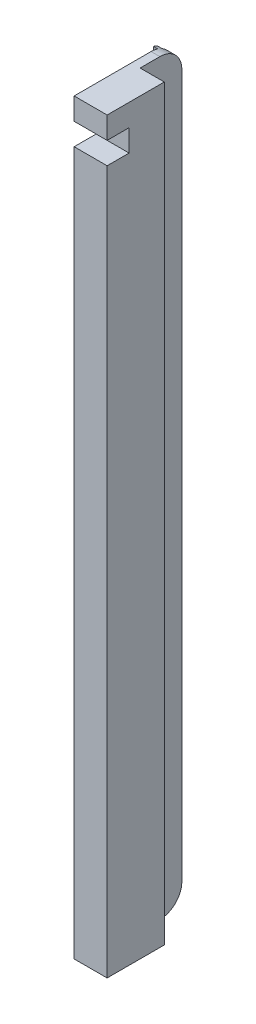
from build123d import *

# Parameters (mm, degrees)
EXTRUDE_1_DEPTH     = 26
SKETCH_1_4_W        = 4
SKETCH_1_4_H        = 340
EXTRUDE_2_DEPTH     = 19
FILLET_1_R          = 10
EXTRUDE_3_DEPTH     = 2
SKETCH_5_W          = 161
SKETCH_5_H          = 6
CUT_EXTRUDE_1_DEPTH = 52
SKETCH_6_W          = 156.446977918
SKETCH_6_H          = 480.108754565
CUT_EXTRUDE_3_DEPTH = 401
SKETCH_7_W          = 10
SKETCH_7_H          = 10
CUT_EXTRUDE_4_DEPTH = 401
EXTRUDE_5_DEPTH     = 2


with BuildPart() as part:
    # 스케치1 → 보스-돌출1 (new body)
    with BuildSketch(Plane.XY):
        Polygon((-168, 0), (168, 0), (183, 0), (183, -340), (168, -340), (168, -20), (-168, -20), (-168, -340), (-183, -340), (-183, 0), align=None)
    extrude(amount=EXTRUDE_1_DEPTH)

    # 스케치1<4> → 보스-돌출2 (add)
    with BuildSketch(Plane.XY):
        with Locations((-170, -170)):
            Rectangle(SKETCH_1_4_W, SKETCH_1_4_H)
        with Locations((170, -170)):
            Rectangle(SKETCH_1_4_W, SKETCH_1_4_H)
    extrude(amount=-EXTRUDE_2_DEPTH)

    # 필렛1
    fillet_1_edges = [part.edges().sort_by_distance(p)[0] for p in [
        (-170, 0, -19),
        (170, 0, -19),
        (170, -340, -19),
        (-170, -340, -19),
    ]]
    fillet(fillet_1_edges, radius=FILLET_1_R)

    # 스케치3 → 보스-돌출3 (add)
    with BuildSketch(Plane.ZY.offset(-168)):
        with BuildLine():
            Line((-12, -339.539392014), (-12, -0.460607986))
            ThreePointArc((-12, -0.460607986), (-13.02408013, -0.845395743), (-14, -1.339745962))
            Line((-14, -1.339745962), (-14, -338.660254038))
            ThreePointArc((-14, -338.660254038), (-13.02408013, -339.154604257), (-12, -339.539392014))
        make_face()
    extrude_3 = extrude(amount=EXTRUDE_3_DEPTH)

    # 대칭 복사1: 보스-돌출3 across plane
    add(extrude_3.mirror(Plane(origin=(0, 0, 0), x_dir=(0, 0, 1), z_dir=(1, 0, 0))))

    # 스케치5 → 컷-돌출1 (cut)
    with BuildSketch(Plane(origin=(0, 0, 0), x_dir=(1, 0, 0), z_dir=(0, 1, 0))):
        with Locations((-87.5, -3)):
            Rectangle(SKETCH_5_W, SKETCH_5_H)
        with Locations((87.5, -3)):
            Rectangle(SKETCH_5_W, SKETCH_5_H)
    extrude(amount=-CUT_EXTRUDE_1_DEPTH, mode=Mode.SUBTRACT)

    # 스케치6 → 컷-돌출3 (cut)
    with BuildSketch(Plane.ZY.offset(-168)):
        with Locations((6.474112075, -134.168402936)):
            Rectangle(SKETCH_6_W, SKETCH_6_H)
    extrude(amount=CUT_EXTRUDE_3_DEPTH, mode=Mode.SUBTRACT)

    # 스케치7 → 컷-돌출4 (cut)
    with BuildSketch(Plane.ZY.offset(-168)):
        with Locations((21, -15)):
            Rectangle(SKETCH_7_W, SKETCH_7_H)
    extrude(amount=-CUT_EXTRUDE_4_DEPTH, mode=Mode.SUBTRACT)

    # 스케치3<3> → 보스-돌출5 (add)
    with BuildSketch(Plane.ZY.offset(-168)):
        with BuildLine():
            Line((-12, -339.539392014), (-12, -0.460607986))
            ThreePointArc((-12, -0.460607986), (-13.02408013, -0.845395743), (-14, -1.339745962))
            Line((-14, -1.339745962), (-14, -338.660254038))
            ThreePointArc((-14, -338.660254038), (-13.02408013, -339.154604257), (-12, -339.539392014))
        make_face()
    extrude(amount=EXTRUDE_5_DEPTH)


solid = part.part
